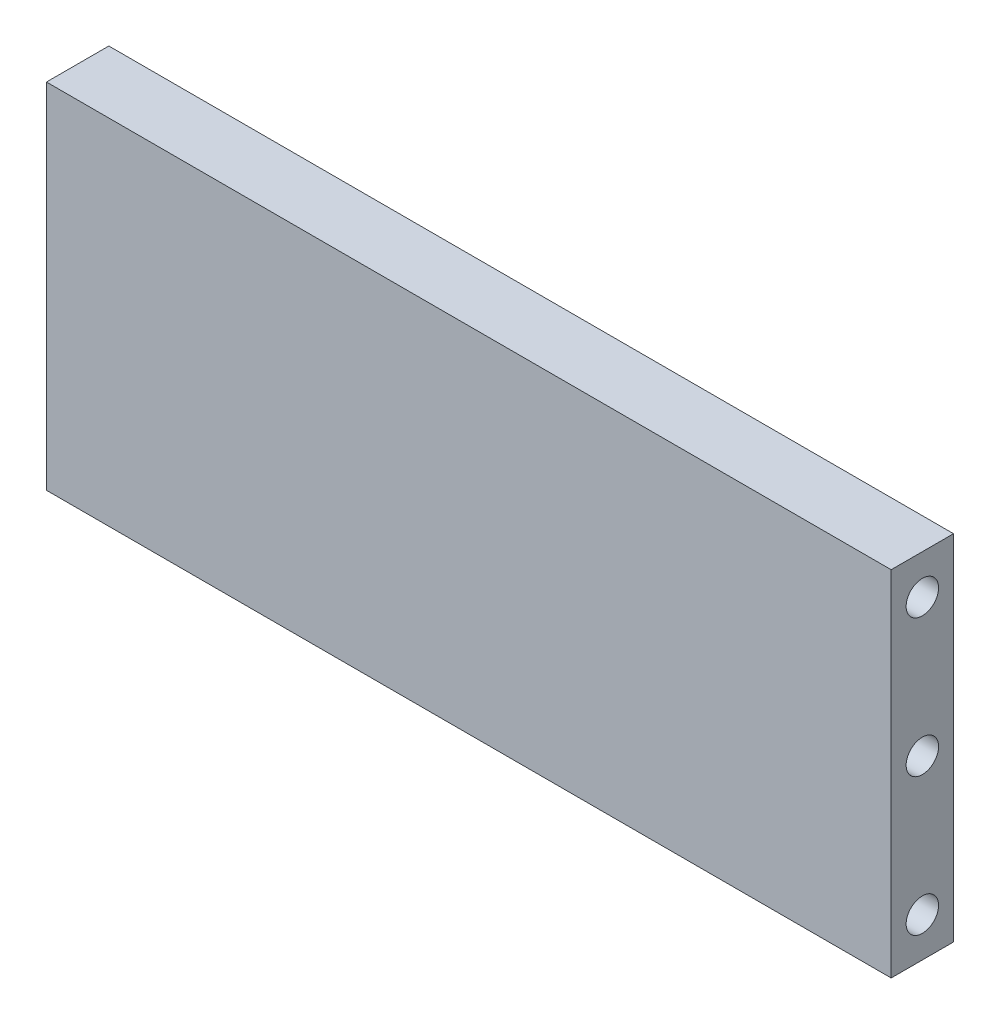
from build123d import *

# Parameters (mm, degrees)
SKETCH1_W           = 86
SKETCH1_H           = 36
BOSS_EXTRUDE1_DEPTH = 3.175
SKETCH2_R           = 1.65
CUT_EXTRUDE1_DEPTH  = 10


with BuildPart() as part:
    # Sketch1 → Boss-Extrude1 (new, symmetric)
    with BuildSketch(Plane.XY):
        Rectangle(SKETCH1_W, SKETCH1_H)
    extrude(amount=BOSS_EXTRUDE1_DEPTH, both=True)

    # Sketch2 → Cut-Extrude1 (cut)
    with BuildSketch(Plane.ZY.offset(43)):
        with Locations((0, 14)):
            Circle(SKETCH2_R)
        with Locations((0, -14)):
            Circle(SKETCH2_R)
        Circle(SKETCH2_R)
    cut_extrude1 = extrude(amount=-CUT_EXTRUDE1_DEPTH, mode=Mode.SUBTRACT)

    # Mirror1: Cut-Extrude1 across plane
    add(cut_extrude1.mirror(Plane(origin=(0, 0, 0), x_dir=(0, 0, 1), z_dir=(1, 0, 0))), mode=Mode.SUBTRACT)


solid = part.part
